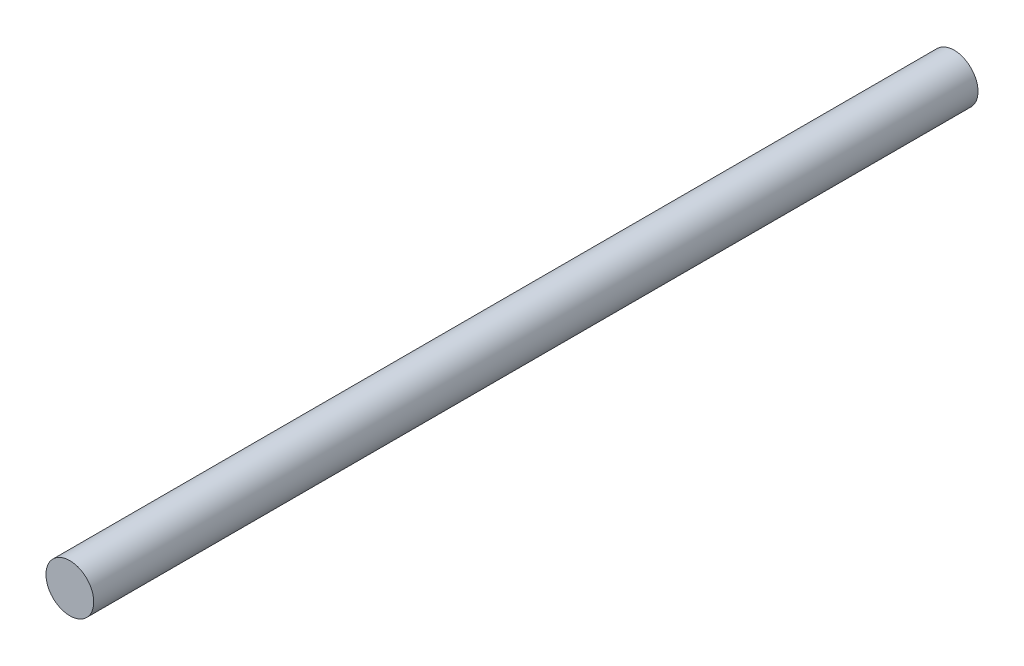
from build123d import *

# Parameters (mm, degrees)
SKIZZE2_R                       = 10
AUFSATZ_LINEAR_AUSTRAGEN1_DEPTH = 370


with BuildPart() as part:
    # Skizze2 → Aufsatz-Linear austragen1 (new body)
    with BuildSketch(Plane.XY):
        Circle(SKIZZE2_R)
    extrude(amount=-AUFSATZ_LINEAR_AUSTRAGEN1_DEPTH)


solid = part.part
